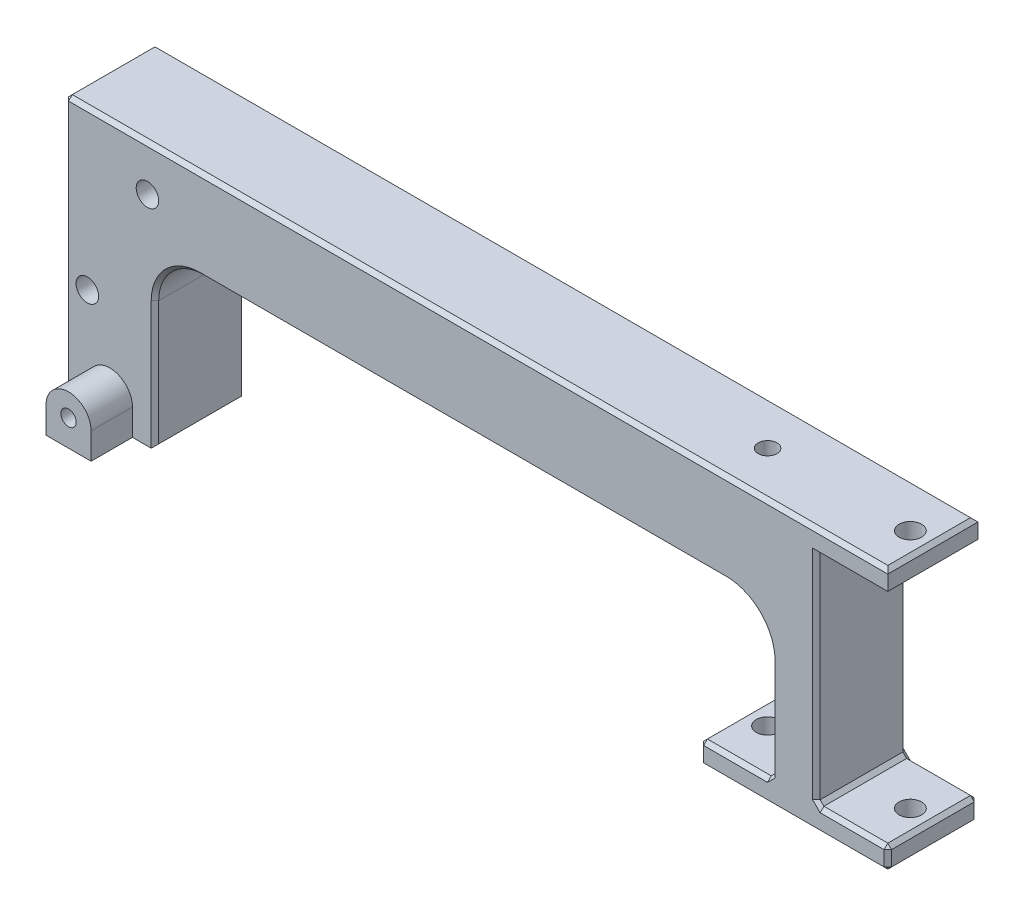
from build123d import *

# Parameters (mm, degrees)
SKETCH1_R                    = 1.5
BOSS_EXTRUDE1_DEPTH          = 6
BOSS_EXTRUDE2_DEPTH          = 5.5
M2_5X0_45_TAPPED_HOLE1_D     = 2.05
M2_5X0_45_TAPPED_HOLE1_DEPTH = 6.234117865
M2_5X0_45_TAPPED_HOLE1_TIP   = 0.615882135
CUT_EXTRUDE1_REACH           = 116.658
SKETCH6_R                    = 1.5
CUT_EXTRUDE2_REACH           = 117.531
SKETCH7_R                    = 1.5
M3X0_5_TAPPED_HOLE1_D        = 2.5
M3X0_5_TAPPED_HOLE1_DEPTH    = 14.5
M3X0_5_TAPPED_HOLE1_TIP      = 0.751075774
CHAMFER1_SIZE                = 0.5


with BuildPart() as part:
    # Sketch1 → Boss-Extrude1 (new, symmetric)
    with BuildSketch(Plane.XY):
        with BuildLine():
            Line((0, 0), (0, 35))
            Line((0, 35), (109.5, 35))
            Line((109.5, 35), (109.5, 32))
            Line((109.5, 32), (100, 32))
            Line((100, 32), (100, 3))
            Line((100, 3), (109.5, 3))
            Line((109.5, 3), (109.5, 0))
            Line((109.5, 0), (84.5, 0))
            Line((84.5, 0), (84.5, 3))
            Line((84.5, 3), (94, 3))
            Line((94, 3), (94, 17))
            ThreePointArc((94, 17), (92.242640687, 21.242640687), (88, 23))
            Line((88, 23), (18, 23))
            ThreePointArc((18, 23), (13.757359313, 21.242640687), (12, 17))
            Line((12, 17), (12, 0))
            Line((12, 0), (0, 0))
        make_face()
        with Locations((11, 29)):
            Circle(SKETCH1_R, mode=Mode.SUBTRACT)
        with Locations((3, 14)):
            Circle(SKETCH1_R, mode=Mode.SUBTRACT)
    extrude(amount=BOSS_EXTRUDE1_DEPTH, both=True)

    # Sketch2 → Boss-Extrude2 (add)
    with BuildSketch(Plane.XY.offset(6)):
        with BuildLine():
            Line((3, 3.5), (3, 0))
            Line((3, 0), (9, 0))
            Line((9, 0), (9, 3.5))
            ThreePointArc((9, 3.5), (6, 6.5), (3, 3.5))
        make_face()
    extrude(amount=BOSS_EXTRUDE2_DEPTH)

    # M2.5x0.45 Tapped Hole1
    with Locations(Plane.XY.offset(11.5)):
        with Locations((6, 3.5)):
            Hole(M2_5X0_45_TAPPED_HOLE1_D / 2, depth=M2_5X0_45_TAPPED_HOLE1_DEPTH)
            with Locations((0, 0, -(M2_5X0_45_TAPPED_HOLE1_DEPTH + M2_5X0_45_TAPPED_HOLE1_TIP / 2))):  # 118° drill point
                Cone(0, M2_5X0_45_TAPPED_HOLE1_D / 2, M2_5X0_45_TAPPED_HOLE1_TIP, mode=Mode.SUBTRACT)

    # Sketch6 → Cut-Extrude1 (cut, up to next)
    with BuildSketch(Plane(origin=(0, 3, 0), x_dir=(1, 0, 0), z_dir=(0, 1, 0)), mode=Mode.PRIVATE) as cut_extrude1_sk1:
        with Locations(Location((87.5, 0, 0), (0, 0, 180))):
            Circle(SKETCH6_R)
    cut_extrude1_tool1 = extrude(cut_extrude1_sk1.sketch, amount=-CUT_EXTRUDE1_REACH, mode=Mode.PRIVATE) & part.part
    # Sketch6 → Cut-Extrude1 (cut, up to next)
    with BuildSketch(Plane(origin=(0, 3, 0), x_dir=(1, 0, 0), z_dir=(0, 1, 0)), mode=Mode.PRIVATE) as cut_extrude1_sk2:
        with Locations(Location((106.5, 0, 0), (0, 0, 180))):
            Circle(SKETCH6_R)
    cut_extrude1_tool2 = extrude(cut_extrude1_sk2.sketch, amount=-CUT_EXTRUDE1_REACH, mode=Mode.PRIVATE) & part.part
    add(cut_extrude1_tool1.solids().sort_by_distance((87.5, 3, 0))[0], mode=Mode.SUBTRACT)
    add(cut_extrude1_tool2.solids().sort_by_distance((106.5, 3, 0))[0], mode=Mode.SUBTRACT)

    # Sketch7 → Cut-Extrude2 (cut, up to next)
    with BuildSketch(Plane(origin=(0, 35, 0), x_dir=(1, 0, 0), z_dir=(0, 1, 0)), mode=Mode.PRIVATE) as cut_extrude2_sk1:
        with Locations(Location((106.5, 0, 0), (0, 0, 180))):
            Circle(SKETCH7_R)
    cut_extrude2_tool1 = extrude(cut_extrude2_sk1.sketch, amount=-CUT_EXTRUDE2_REACH, mode=Mode.PRIVATE) & part.part
    add(cut_extrude2_tool1.solids().sort_by_distance((106.5, 35, 0))[0], mode=Mode.SUBTRACT)

    # M3x0.5 Tapped Hole1
    with Locations(Plane(origin=(0, 35, 0), x_dir=(1, 0, 0), z_dir=(0, 1, 0))):
        with Locations((87.5, 0)):
            Hole(M3X0_5_TAPPED_HOLE1_D / 2, depth=M3X0_5_TAPPED_HOLE1_DEPTH)
            with Locations((0, 0, -(M3X0_5_TAPPED_HOLE1_DEPTH + M3X0_5_TAPPED_HOLE1_TIP / 2))):  # 118° drill point
                Cone(0, M3X0_5_TAPPED_HOLE1_D / 2, M3X0_5_TAPPED_HOLE1_TIP, mode=Mode.SUBTRACT)

    # Chamfer1
    chamfer1_edges = [part.edges().sort_by_distance(p)[0] for p in [
        (12, 8.5, -6),
        (12, 8.5, 6),
        (13.757359313, 21.242640687, -6),
        (13.757359313, 21.242640687, 6),
        (53, 23, -6),
        (53, 23, 6),
        (92.242640687, 21.242640687, -6),
        (92.242640687, 21.242640687, 6),
        (97, 0, 6),
        (109.5, 0, 0),
        (84.5, 0, 0),
        (94, 3, 0),
        (94, 10, -6),
        (89.25, 3, -6),
        (84.5, 1.5, 6),
        (94, 10, 6),
        (89.25, 3, 6),
        (84.5, 3, 0),
        (84.5, 1.5, -6),
        (97, 0, -6),
        (100, 3, 0),
        (109.5, 1.5, 6),
        (109.5, 1.5, -6),
        (104.75, 32, -6),
        (109.5, 32, 0),
        (104.75, 32, 6),
        (100, 17.5, -6),
        (104.75, 3, -6),
        (109.5, 3, 0),
        (104.75, 3, 6),
        (100, 17.5, 6),
        (0, 17.5, -6),
        (12, 0, 0),
        (6, 0, -6),
        (0, 35, 0),
        (0, 0, 0),
        (54.75, 35, -6),
        (109.5, 35, 0),
        (54.75, 35, 6),
        (0, 17.5, 6),
    ]]
    chamfer(chamfer1_edges, length=CHAMFER1_SIZE)


solid = part.part
